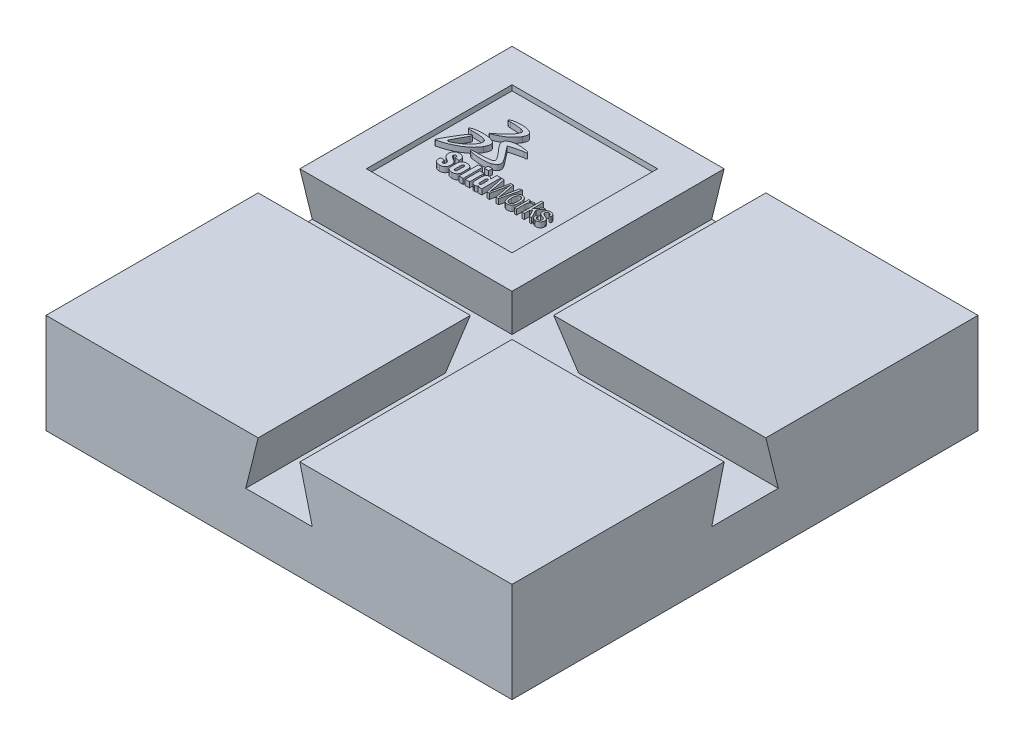
from build123d import *

# Parameters (mm, degrees)
SKETCH1_W          = 88.9
SKETCH1_H          = 88.9
BASE_EXTRUDE_DEPTH = 19.05
CUT_EXTRUDE1_DEPTH = 102.202346811
CUT_EXTRUDE2_DEPTH = 103.21917076
SKETCH8_W          = 27.774849227
SKETCH8_H          = 27.774849227
CUT_EXTRUDE4_DEPTH = 1.016
SKETCH7_W          = 0.807647572
SKETCH7_H          = 3.689453661
SKETCH7_W_2        = 0.825597864
SKETCH7_H_2        = 2.776797052
SKETCH7_H_3        = 0.698475923
EXTRUDE1_DEPTH     = 1.016


with BuildPart() as part:
    # Sketch1 → Base-Extrude (new body)
    with BuildSketch(Plane(origin=(0, 0, 0), x_dir=(1, 0, 0), z_dir=(0, 1, 0))):
        Rectangle(SKETCH1_W, SKETCH1_H)
    extrude(amount=BASE_EXTRUDE_DEPTH)

    # Sketch2 → Cut-Extrude1 (cut, through all)
    with BuildSketch(Plane.XY.offset(44.45)):
        Polygon((6.35, 9.525), (-6.35, 9.525), (-3.975150773, 19.05), (3.975150773, 19.05), align=None)
    extrude(amount=-CUT_EXTRUDE1_DEPTH, mode=Mode.SUBTRACT)

    # Sketch3 → Cut-Extrude2 (cut, through all)
    with BuildSketch(Plane(origin=(44.45, -3.538159269, -0.664564519), x_dir=(0, 0, -1), z_dir=(1, 0, 0))):
        Polygon((5.685435481, 13.063159269), (-7.014564519, 13.063159269), (-4.639715292, 22.588159269), (3.310586254, 22.588159269), align=None)
    extrude(amount=-CUT_EXTRUDE2_DEPTH, mode=Mode.SUBTRACT)

    # Sketch8 → Cut-Extrude4 (cut)
    with BuildSketch(Plane(origin=(0, 19.05, 0), x_dir=(-1, 0, 0), z_dir=(0, 1, 0))):
        with Locations((24.212575386, -24.212575386)):
            Rectangle(SKETCH8_W, SKETCH8_H)
    extrude(amount=-CUT_EXTRUDE4_DEPTH, mode=Mode.SUBTRACT)

    # Sketch7 → Extrude1 (add)
    # profile 1 of 14: a face of its own
    with BuildSketch(Plane(origin=(-67.01261786, 18.034, 30.420535438), x_dir=(1, 0, 0), z_dir=(0, 1, 0))):
        Polygon((51.349629564, 49.970708333), (52.291167219, 51.169291667), (52.701371045, 51.169291667), (51.87761312, 50.120642668), (52.763773299, 48.431204182), (52.320606228, 48.431204182), (51.611882291, 49.782365658), (51.349629564, 49.448516293), (51.349629564, 48.429902778), (50.929645629, 48.429902778), (50.929645629, 52.086861111), (51.349629564, 52.086861111), align=None)
    # profile 2 of 14: a face of its own
    with BuildSketch(Plane(origin=(-67.01261786, 18.034, 30.420535438), x_dir=(1, 0, 0), z_dir=(0, 1, 0))):
        with Locations((39.331135311, 50.242134281)):
            Rectangle(SKETCH7_W, SKETCH7_H)
    # profile 3 of 14: a face of its own
    with BuildSketch(Plane(origin=(-67.01261786, 18.034, 30.420535438), x_dir=(1, 0, 0), z_dir=(0, 1, 0))):
        with Locations((40.488775846, 49.818301304)):
            Rectangle(SKETCH7_W_2, SKETCH7_H_2)
    # profile 4 of 14: a face of its own
    with BuildSketch(Plane(origin=(-67.01261786, 18.034, 30.420535438), x_dir=(1, 0, 0), z_dir=(0, 1, 0))):
        with Locations((40.488775846, 52.436099072)):
            Rectangle(SKETCH7_W_2, SKETCH7_H_3)
    # profile 5 of 14: a face of its own
    with BuildSketch(Plane(origin=(-67.01261786, 18.034, 30.420535438), x_dir=(1, 0, 0), z_dir=(0, 1, 0))):
        with BuildLine():
            add(Edge.make_bspline(
                [(34.874736111, 62.6315), (34.701, 62.580638889), (34.350388889, 62.484194444), (34.380083333, 62.356361111)],
                knots=[0, 0, 0, 0, 1, 1, 1, 1], degree=3))
            add(Edge.make_bspline(
                [(34.380083333, 62.356361111), (34.398944444, 62.274305556), (34.468652778, 62.23525), (34.875625, 62.235652778)],
                knots=[0, 0, 0, 0, 1, 1, 1, 1], degree=3))
            add(Edge.make_bspline(
                [(34.875625, 62.235652778), (35.786263889, 62.236805556), (36.494208333, 62.177666667), (36.978833333, 62.090791667)],
                knots=[0, 0, 0, 0, 1, 1, 1, 1], degree=3))
            add(Edge.make_bspline(
                [(36.978833333, 62.090791667), (37.964888889, 61.912777778), (37.732680556, 61.415208333), (37.452458333, 60.938930556)],
                knots=[0, 0, 0, 0, 1, 1, 1, 1], degree=3))
            add(Edge.make_bspline(
                [(37.452458333, 60.938930556), (36.772458333, 59.779666667), (34.936111111, 58.475347222), (34.829569444, 58.401833333)],
                knots=[0, 0, 0, 0, 1, 1, 1, 1], degree=3))
            add(Edge.make_bspline(
                [(34.829569444, 58.401833333), (34.689597222, 58.305263889), (34.766097222, 58.249041667), (34.888513889, 58.294611111)],
                knots=[0, 0, 0, 0, 1, 1, 1, 1], degree=3))
            add(Edge.make_bspline(
                [(34.888513889, 58.294611111), (36.377569444, 58.848402778), (37.877944444, 59.803472222), (38.483888889, 60.963680556)],
                knots=[0, 0, 0, 0, 1, 1, 1, 1], degree=3))
            add(Edge.make_bspline(
                [(38.483888889, 60.963680556), (38.998, 61.947694444), (38.629486111, 62.414680556), (37.845930556, 62.634555556)],
                knots=[0, 0, 0, 0, 1, 1, 1, 1], degree=3))
            add(Edge.make_bspline(
                [(37.845930556, 62.634555556), (36.447277778, 63.028152778), (34.996875, 62.667638889), (34.874736111, 62.6315)],
                knots=[0, 0, 0, 0, 1, 1, 1, 1], degree=3))
        make_face()
    # profile 6 of 14: a face of its own
    with BuildSketch(Plane(origin=(-67.01261786, 18.034, 30.420535438), x_dir=(1, 0, 0), z_dir=(0, 1, 0))):
        with BuildLine():
            add(Edge.make_bspline(
                [(37.687583333, 58.660208333), (36.90775, 57.985902778), (38.064444444, 56.875), (38.608194444, 56.238069444)],
                knots=[0, 0, 0, 0, 1, 1, 1, 1], degree=3))
            add(Edge.make_bspline(
                [(38.608194444, 56.238069444), (39.1375, 55.619027778), (39.777972222, 54.833166667), (39.808083333, 54.563263889)],
                knots=[0, 0, 0, 0, 1, 1, 1, 1], degree=3))
            add(Edge.make_bspline(
                [(39.808083333, 54.563263889), (39.821638889, 54.439555556), (39.796958333, 54.298902778), (39.648777778, 54.207083333)],
                knots=[0, 0, 0, 0, 1, 1, 1, 1], degree=3))
            add(Edge.make_bspline(
                [(39.648777778, 54.207083333), (39.406541667, 54.055722222), (38.406444444, 53.909638889), (36.337819444, 53.911541667)],
                knots=[0, 0, 0, 0, 1, 1, 1, 1], degree=3))
            add(Edge.make_bspline(
                [(36.337819444, 53.911541667), (35.889013889, 53.911944444), (35.797458333, 53.868), (35.785930556, 53.787569444)],
                knots=[0, 0, 0, 0, 1, 1, 1, 1], degree=3))
            add(Edge.make_bspline(
                [(35.785930556, 53.787569444), (35.779555556, 53.745388889), (35.765791667, 53.648), (36.336805556, 53.5045)],
                knots=[0, 0, 0, 0, 1, 1, 1, 1], degree=3))
            add(Edge.make_bspline(
                [(36.336805556, 53.5045), (36.352263889, 53.500166667), (38.707611111, 53.067222222), (39.963791667, 53.5045)],
                knots=[0, 0, 0, 0, 1, 1, 1, 1], degree=3))
            add(Edge.make_bspline(
                [(39.963791667, 53.5045), (41.246944444, 53.942333333), (40.924138889, 54.681527778), (40.693833333, 55.108375)],
                knots=[0, 0, 0, 0, 1, 1, 1, 1], degree=3))
            add(Edge.make_bspline(
                [(40.693833333, 55.108375), (40.339361111, 55.766055556), (38.704013889, 57.678222222), (38.569069444, 57.938166667)],
                knots=[0, 0, 0, 0, 1, 1, 1, 1], degree=3))
            add(Edge.make_bspline(
                [(41.080791667, 58.598430556), (40.938049657, 58.599550827), (38.535399297, 58.003025711), (38.569069444, 57.938166667)],
                knots=[0, 0, 0, 0, 1, 1, 1, 1], degree=3))
            add(Edge.make_bspline(
                [(41.080791667, 58.598430556), (41.530291667, 58.594902778), (41.623597222, 58.641833333), (41.634041667, 58.722736111)],
                knots=[0, 0, 0, 0, 1, 1, 1, 1], degree=3))
            add(Edge.make_bspline(
                [(41.634041667, 58.722736111), (41.642861111, 58.789666667), (41.514555556, 58.935138889), (41.087166667, 59.026555556)],
                knots=[0, 0, 0, 0, 1, 1, 1, 1], degree=3))
            add(Edge.make_bspline(
                [(41.087166667, 59.026555556), (40.684208333, 59.113222222), (38.623111111, 59.468930556), (37.687583333, 58.660208333)],
                knots=[0, 0, 0, 0, 1, 1, 1, 1], degree=3))
        make_face()
    # profile 7 of 14: a face of its own
    with BuildSketch(Plane(origin=(-67.01261786, 18.034, 30.420535438), x_dir=(1, 0, 0), z_dir=(0, 1, 0))):
        with BuildLine():
            add(Edge.make_bspline(
                [(35.763888889, 57.537430556), (34.312541667, 57.966722222), (32.730375, 57.593722222), (32.489013889, 57.529708333)],
                knots=[0, 0, 0, 0, 1, 1, 1, 1], degree=3))
            add(Edge.make_bspline(
                [(32.489013889, 57.529708333), (32.12375, 57.432930556), (31.909583333, 57.335277778), (31.9245, 57.220791667)],
                knots=[0, 0, 0, 0, 1, 1, 1, 1], degree=3))
            add(Edge.make_bspline(
                [(31.9245, 57.220791667), (31.935972222, 57.136236111), (32.029277778, 57.077972222), (32.478361111, 57.089027778)],
                knots=[0, 0, 0, 0, 1, 1, 1, 1], degree=3))
            add(Edge.make_bspline(
                [(32.478361111, 57.089027778), (33.548513889, 57.115), (34.435361111, 57.078861111), (34.995722222, 56.921861111)],
                knots=[0, 0, 0, 0, 1, 1, 1, 1], degree=3))
            add(Edge.make_bspline(
                [(34.995722222, 56.921861111), (35.689902778, 56.728180556), (35.775208333, 56.370708333), (35.431722222, 55.668263889)],
                knots=[0, 0, 0, 0, 1, 1, 1, 1], degree=3))
            add(Edge.make_bspline(
                [(35.431722222, 55.668263889), (35.272694444, 55.343694444), (35.037569444, 55.008138889), (34.681527778, 54.651694444)],
                knots=[0, 0, 0, 0, 1, 1, 1, 1], degree=3))
            add(Edge.make_bspline(
                [(34.681527778, 54.651694444), (33.970875, 53.938805556), (33.08275, 53.474527778), (32.582402778, 53.221305556)],
                knots=[0, 0, 0, 0, 1, 1, 1, 1], degree=3))
            add(Edge.make_bspline(
                [(32.582402778, 53.221305556), (32.09575, 52.974444444), (31.917930556, 53.105472222), (31.971972222, 53.349069444)],
                knots=[0, 0, 0, 0, 1, 1, 1, 1], degree=3))
            add(Edge.make_bspline(
                [(31.971972222, 53.349069444), (31.976340303, 53.368758926), (33.368260133, 55.947613541), (33.418777778, 56.035902778)],
                knots=[0, 0, 0, 0, 1, 1, 1, 1], degree=3))
            add(Edge.make_bspline(
                [(33.418777778, 56.035902778), (33.522541667, 56.21725), (33.540791667, 56.387666667), (33.418777778, 56.438666667)],
                knots=[0, 0, 0, 0, 1, 1, 1, 1], degree=3))
            add(Edge.make_bspline(
                [(33.418777778, 56.438666667), (33.314069444, 56.483083333), (33.124388889, 56.336055556), (32.92725, 56.108125)],
                knots=[0, 0, 0, 0, 1, 1, 1, 1], degree=3))
            add(Edge.make_bspline(
                [(32.92725, 56.108125), (32.121722222, 55.172527778), (30.635916667, 52.325847222), (30.608513889, 52.232263889)],
                knots=[0, 0, 0, 0, 1, 1, 1, 1], degree=3))
            add(Edge.make_bspline(
                [(30.608513889, 52.232263889), (30.581125, 52.142736111), (30.650972222, 52.131625), (30.677763889, 52.131083333)],
                knots=[0, 0, 0, 0, 1, 1, 1, 1], degree=3))
            add(Edge.make_bspline(
                [(30.677763889, 52.131083333), (31.306763889, 52.135694444), (35.168722222, 53.278), (36.414861111, 55.612527778)],
                knots=[0, 0, 0, 0, 1, 1, 1, 1], degree=3))
            add(Edge.make_bspline(
                [(36.414861111, 55.612527778), (37.070986111, 56.841902778), (36.739027778, 57.248666667), (35.763888889, 57.537430556)],
                knots=[0, 0, 0, 0, 1, 1, 1, 1], degree=3))
        make_face()
    # profile 8 of 14: a face of its own
    with BuildSketch(Plane(origin=(-67.01261786, 18.034, 30.420535438), x_dir=(1, 0, 0), z_dir=(0, 1, 0))):
        with BuildLine():
            add(Edge.make_bspline(
                [(54.047583333, 50.413958333), (54.062777778, 50.736222222), (53.946944444, 50.887319444), (53.618430556, 50.887319444)],
                knots=[0, 0, 0, 0, 1, 1, 1, 1], degree=3))
            add(Edge.make_bspline(
                [(53.618430556, 50.887319444), (53.345541667, 50.887319444), (53.189555556, 50.759819444), (53.189555556, 50.477152778)],
                knots=[0, 0, 0, 0, 1, 1, 1, 1], degree=3))
            add(Edge.make_bspline(
                [(53.189555556, 50.477152778), (53.189555556, 50.126958333), (53.477375, 50.082194444), (53.741597222, 49.970708333)],
                knots=[0, 0, 0, 0, 1, 1, 1, 1], degree=3))
            add(Edge.make_bspline(
                [(53.741597222, 49.970708333), (54.130583333, 49.793972222), (54.521486111, 49.697263889), (54.521486111, 49.19)],
                knots=[0, 0, 0, 0, 1, 1, 1, 1], degree=3))
            add(Edge.make_bspline(
                [(54.521486111, 49.19), (54.521486111, 48.672694444), (54.160430556, 48.350416667), (53.603513889, 48.355847222)],
                knots=[0, 0, 0, 0, 1, 1, 1, 1], degree=3))
            add(Edge.make_bspline(
                [(53.603513889, 48.355847222), (53.364805556, 48.350416667), (53.072916667, 48.433569444), (52.930777778, 48.638513889)],
                knots=[0, 0, 0, 0, 1, 1, 1, 1], degree=3))
            add(Edge.make_bspline(
                [(52.930777778, 48.638513889), (52.770180556, 48.852944444), (52.779402778, 49.033611111), (52.779402778, 49.219027778)],
                knots=[0, 0, 0, 0, 1, 1, 1, 1], degree=3))
            Line((52.779402778, 49.219027778), (53.146152778, 49.219027778))
            add(Edge.make_bspline(
                [(53.146152778, 49.219027778), (53.131777778, 48.887263889), (53.243541667, 48.682180556), (53.603513889, 48.682180556)],
                knots=[0, 0, 0, 0, 1, 1, 1, 1], degree=3))
            add(Edge.make_bspline(
                [(53.603513889, 48.682180556), (53.917375, 48.682180556), (54.121638889, 48.809402778), (54.121638889, 49.140902778)],
                knots=[0, 0, 0, 0, 1, 1, 1, 1], degree=3))
            add(Edge.make_bspline(
                [(54.121638889, 49.140902778), (54.121638889, 49.526097222), (53.731277778, 49.560541667), (53.453236111, 49.678)],
                knots=[0, 0, 0, 0, 1, 1, 1, 1], degree=3))
            add(Edge.make_bspline(
                [(53.453236111, 49.678), (53.033861111, 49.833444444), (52.789708333, 49.975041667), (52.789708333, 50.447597222)],
                knots=[0, 0, 0, 0, 1, 1, 1, 1], degree=3))
            add(Edge.make_bspline(
                [(52.789708333, 50.447597222), (52.789708333, 50.917152778), (53.116861111, 51.214597222), (53.585069444, 51.214597222)],
                knots=[0, 0, 0, 0, 1, 1, 1, 1], degree=3))
            add(Edge.make_bspline(
                [(53.585069444, 51.214597222), (54.121638889, 51.214597222), (54.433597222, 50.969513889), (54.423555556, 50.413958333)],
                knots=[0, 0, 0, 0, 1, 1, 1, 1], degree=3))
            Line((54.423555556, 50.413958333), (54.047583333, 50.413958333))
        make_face()
    # profile 9 of 14: a face of its own
    with BuildSketch(Plane(origin=(-67.01261786, 18.034, 30.420535438), x_dir=(1, 0, 0), z_dir=(0, 1, 0))):
        with BuildLine():
            Line((49.869513889, 50.697694444), (49.879555556, 50.697694444))
            add(Edge.make_bspline(
                [(49.879555556, 50.697694444), (50.039875, 51.053333333), (50.269916667, 51.204430556), (50.673555556, 51.169291667)],
                knots=[0, 0, 0, 0, 1, 1, 1, 1], degree=3))
            Line((50.673555556, 51.169291667), (50.673555556, 50.789527778))
            add(Edge.make_bspline(
                [(50.673555556, 50.789527778), (50.176319444, 50.877555556), (49.883361111, 50.565597222), (49.883361111, 50.073236111)],
                knots=[0, 0, 0, 0, 1, 1, 1, 1], degree=3))
            Line((49.883361111, 50.073236111), (49.883361111, 48.429902778))
            Line((49.883361111, 48.429902778), (49.498152778, 48.429902778))
            Line((49.498152778, 48.429902778), (49.498152778, 51.140680556))
            Line((49.498152778, 51.140680556), (49.869513889, 51.140680556))
            Line((49.869513889, 51.140680556), (49.869513889, 50.697694444))
        make_face()
    # profile 10 of 14: a face of its own
    with BuildSketch(Plane(origin=(-67.01261786, 18.034, 30.420535438), x_dir=(1, 0, 0), z_dir=(0, 1, 0))):
        with BuildLine():
            add(Edge.make_bspline(
                [(48.168944444, 48.355847222), (47.584097222, 48.355847222), (47.199166667, 48.707138889), (47.199166667, 49.877388889)],
                knots=[0, 0, 0, 0, 1, 1, 1, 1], degree=3))
            add(Edge.make_bspline(
                [(47.199166667, 49.877388889), (47.199166667, 50.697694444), (47.500819444, 51.214597222), (48.168944444, 51.214597222)],
                knots=[0, 0, 0, 0, 1, 1, 1, 1], degree=3))
            add(Edge.make_bspline(
                [(48.168944444, 51.214597222), (48.837625, 51.214597222), (49.140625, 50.697694444), (49.140625, 49.877388889)],
                knots=[0, 0, 0, 0, 1, 1, 1, 1], degree=3))
            add(Edge.make_bspline(
                [(49.140625, 49.877388889), (49.140625, 48.702805556), (48.764375, 48.355847222), (48.168944444, 48.355847222)],
                knots=[0, 0, 0, 0, 1, 1, 1, 1], degree=3))
        make_face()
        with BuildLine():
            add(Edge.make_bspline(
                [(48.168944444, 50.887319444), (47.775069444, 50.887319444), (47.598472222, 50.575902778), (47.598472222, 49.755319444)],
                knots=[0, 0, 0, 0, 1, 1, 1, 1], degree=3))
            add(Edge.make_bspline(
                [(47.598472222, 49.755319444), (47.598472222, 49.116486111), (47.720805556, 48.682180556), (48.168944444, 48.682180556)],
                knots=[0, 0, 0, 0, 1, 1, 1, 1], degree=3))
            add(Edge.make_bspline(
                [(48.168944444, 48.682180556), (48.627111111, 48.682180556), (48.739416667, 49.116486111), (48.739416667, 49.755319444)],
                knots=[0, 0, 0, 0, 1, 1, 1, 1], degree=3))
            add(Edge.make_bspline(
                [(48.739416667, 49.755319444), (48.739416667, 50.575902778), (48.574486111, 50.887319444), (48.168944444, 50.887319444)],
                knots=[0, 0, 0, 0, 1, 1, 1, 1], degree=3))
        make_face(mode=Mode.SUBTRACT)
    # profile 11 of 14: a face of its own
    with BuildSketch(Plane(origin=(-67.01261786, 18.034, 30.420535438), x_dir=(1, 0, 0), z_dir=(0, 1, 0))):
        with BuildLine():
            Line((44.695361111, 48.429902778), (44.192305556, 48.429902778))
            Line((44.192305556, 48.429902778), (43.412541667, 52.086861111))
            Line((43.412541667, 52.086861111), (43.861486111, 52.086861111))
            Line((43.861486111, 52.086861111), (44.33825, 49.565152778))
            add(Edge.make_bspline(
                [(44.33825, 49.565152778), (44.382597222, 49.316944444), (44.417041667, 49.063041667), (44.44675, 48.721791667)],
                knots=[0, 0, 0, 0, 1, 1, 1, 1], degree=3))
            Line((44.44675, 48.721791667), (44.456111111, 48.721791667))
            add(Edge.make_bspline(
                [(44.456111111, 48.721791667), (44.490152778, 49.004180556), (44.519319444, 49.272458333), (44.573430556, 49.536138889)],
                knots=[0, 0, 0, 0, 1, 1, 1, 1], degree=3))
            Line((44.573430556, 49.536138889), (45.109861111, 52.086861111))
            Line((45.109861111, 52.086861111), (45.611430556, 52.086861111))
            Line((45.611430556, 52.086861111), (46.095916667, 49.565152778))
            add(Edge.make_bspline(
                [(46.095916667, 49.565152778), (46.137972222, 49.321291667), (46.167263889, 49.077833333), (46.201708333, 48.721791667)],
                knots=[0, 0, 0, 0, 1, 1, 1, 1], degree=3))
            Line((46.201708333, 48.721791667), (46.212027778, 48.721791667))
            add(Edge.make_bspline(
                [(46.212027778, 48.721791667), (46.245666667, 49.004180556), (46.274958333, 49.272458333), (46.329208333, 49.536138889)],
                knots=[0, 0, 0, 0, 1, 1, 1, 1], degree=3))
            Line((46.329208333, 49.536138889), (46.860083333, 52.086861111))
            Line((46.860083333, 52.086861111), (47.309847222, 52.086861111))
            Line((47.309847222, 52.086861111), (46.451277778, 48.429902778))
            Line((46.451277778, 48.429902778), (45.949166667, 48.429902778))
            Line((45.949166667, 48.429902778), (45.461430556, 50.911736111))
            add(Edge.make_bspline(
                [(45.461430556, 50.911736111), (45.413, 51.150847222), (45.384111111, 51.394319444), (45.353736111, 51.794430556)],
                knots=[0, 0, 0, 0, 1, 1, 1, 1], degree=3))
            Line((45.353736111, 51.794430556), (45.343555556, 51.794430556))
            add(Edge.make_bspline(
                [(45.343555556, 51.794430556), (45.310333333, 51.442875), (45.280625, 51.175944444), (45.227055556, 50.911736111)],
                knots=[0, 0, 0, 0, 1, 1, 1, 1], degree=3))
            Line((45.227055556, 50.911736111), (44.695361111, 48.429902778))
        make_face()
    # profile 12 of 14: a face of its own
    with BuildSketch(Plane(origin=(-67.01261786, 18.034, 30.420535438), x_dir=(1, 0, 0), z_dir=(0, 1, 0))):
        with BuildLine():
            Line((42.514652778, 48.429902778), (42.514652778, 48.746069444))
            Line((42.514652778, 48.746069444), (42.505430556, 48.746069444))
            add(Edge.make_bspline(
                [(42.505430556, 48.746069444), (42.363138889, 48.482125), (42.129319444, 48.341194444), (41.900569444, 48.341194444)],
                knots=[0, 0, 0, 0, 1, 1, 1, 1], degree=3))
            add(Edge.make_bspline(
                [(41.900569444, 48.341194444), (41.334569444, 48.360736111), (41.221861111, 48.892138889), (41.221861111, 49.356013889)],
                knots=[0, 0, 0, 0, 1, 1, 1, 1], degree=3))
            Line((41.221861111, 49.356013889), (41.221861111, 50.301652778))
            add(Edge.make_bspline(
                [(41.221861111, 50.301652778), (41.221861111, 50.731194444), (41.373222222, 51.238611111), (41.885916667, 51.238611111)],
                knots=[0, 0, 0, 0, 1, 1, 1, 1], degree=3))
            add(Edge.make_bspline(
                [(41.885916667, 51.238611111), (42.091402778, 51.238611111), (42.290111111, 51.150847222), (42.450430556, 50.911736111)],
                knots=[0, 0, 0, 0, 1, 1, 1, 1], degree=3))
            Line((42.450430556, 50.911736111), (42.460805556, 50.911736111))
            Line((42.460805556, 50.911736111), (42.460805556, 52.086861111))
            Line((42.460805556, 52.086861111), (43.236763889, 52.086861111))
            Line((43.236763889, 52.086861111), (43.236763889, 48.429902778))
            Line((43.236763889, 48.429902778), (42.514652778, 48.429902778))
        make_face()
        with BuildLine():
            add(Edge.make_bspline(
                [(41.997958333, 49.414472222), (41.997958333, 49.253069444), (41.997958333, 48.975416667), (42.22175, 48.975416667)],
                knots=[0, 0, 0, 0, 1, 1, 1, 1], degree=3))
            add(Edge.make_bspline(
                [(42.22175, 48.975416667), (42.431166667, 48.975416667), (42.460805556, 49.184569444), (42.460805556, 49.448791667)],
                knots=[0, 0, 0, 0, 1, 1, 1, 1], degree=3))
            Line((42.460805556, 49.448791667), (42.460805556, 50.0925))
            add(Edge.make_bspline(
                [(42.460805556, 50.0925), (42.460805556, 50.326611111), (42.426152778, 50.609541667), (42.235986111, 50.603847222)],
                knots=[0, 0, 0, 0, 1, 1, 1, 1], degree=3))
            add(Edge.make_bspline(
                [(42.235986111, 50.603847222), (41.988319444, 50.603847222), (41.997958333, 50.2965), (41.997958333, 50.121125)],
                knots=[0, 0, 0, 0, 1, 1, 1, 1], degree=3))
            Line((41.997958333, 50.121125), (41.997958333, 49.414472222))
        make_face(mode=Mode.SUBTRACT)
    # profile 13 of 14: a face of its own
    with BuildSketch(Plane(origin=(-67.01261786, 18.034, 30.420535438), x_dir=(1, 0, 0), z_dir=(0, 1, 0))):
        with BuildLine():
            add(Edge.make_bspline(
                [(36.61025, 50.301652778), (36.61025, 51.004638889), (37.025208333, 51.238611111), (37.624444444, 51.238611111)],
                knots=[0, 0, 0, 0, 1, 1, 1, 1], degree=3))
            add(Edge.make_bspline(
                [(37.624444444, 51.238611111), (38.307902778, 51.238611111), (38.639125, 50.917152778), (38.639125, 50.301652778)],
                knots=[0, 0, 0, 0, 1, 1, 1, 1], degree=3))
            Line((38.639125, 50.301652778), (38.639125, 49.19))
            add(Edge.make_bspline(
                [(38.639125, 49.19), (38.599652778, 48.570416667), (38.214861111, 48.341194444), (37.624444444, 48.341194444)],
                knots=[0, 0, 0, 0, 1, 1, 1, 1], degree=3))
            add(Edge.make_bspline(
                [(37.624444444, 48.341194444), (37.068486111, 48.341194444), (36.61025, 48.565263889), (36.61025, 49.19)],
                knots=[0, 0, 0, 0, 1, 1, 1, 1], degree=3))
            Line((36.61025, 49.19), (36.61025, 50.301652778))
        make_face()
        with BuildLine():
            add(Edge.make_bspline(
                [(37.386472222, 49.140902778), (37.400444444, 48.984652778), (37.464527778, 48.901916667), (37.624444444, 48.901916667)],
                knots=[0, 0, 0, 0, 1, 1, 1, 1], degree=3))
            add(Edge.make_bspline(
                [(37.624444444, 48.901916667), (37.785847222, 48.901916667), (37.848652778, 48.984652778), (37.863708333, 49.140902778)],
                knots=[0, 0, 0, 0, 1, 1, 1, 1], degree=3))
            Line((37.863708333, 49.140902778), (37.863708333, 50.361055556))
            add(Edge.make_bspline(
                [(37.863708333, 50.361055556), (37.863708333, 50.53575), (37.80525, 50.677902778), (37.624444444, 50.677902778)],
                knots=[0, 0, 0, 0, 1, 1, 1, 1], degree=3))
            add(Edge.make_bspline(
                [(37.624444444, 50.677902778), (37.444055556, 50.677902778), (37.386472222, 50.53575), (37.386472222, 50.361055556)],
                knots=[0, 0, 0, 0, 1, 1, 1, 1], degree=3))
            Line((37.386472222, 50.361055556), (37.386472222, 49.140902778))
        make_face(mode=Mode.SUBTRACT)
    # profile 14 of 14: a face of its own
    with BuildSketch(Plane(origin=(-67.01261786, 18.034, 30.420535438), x_dir=(1, 0, 0), z_dir=(0, 1, 0))):
        with BuildLine():
            Line((34.939375, 49.653458333), (34.939375, 49.394388889))
            add(Edge.make_bspline(
                [(34.939375, 49.394388889), (34.939375, 49.184569444), (35.008472222, 48.999152778), (35.280958333, 48.999152778)],
                knots=[0, 0, 0, 0, 1, 1, 1, 1], degree=3))
            add(Edge.make_bspline(
                [(35.280958333, 48.999152778), (35.481097222, 48.999152778), (35.568777778, 49.179694444), (35.568777778, 49.365375)],
                knots=[0, 0, 0, 0, 1, 1, 1, 1], degree=3))
            add(Edge.make_bspline(
                [(35.568777778, 49.365375), (35.568777778, 49.672583333), (35.315277778, 49.789222222), (35.091277778, 49.926347222)],
                knots=[0, 0, 0, 0, 1, 1, 1, 1], degree=3))
            add(Edge.make_bspline(
                [(35.091277778, 49.926347222), (34.827, 50.077444444), (34.603277778, 50.218916667), (34.442888889, 50.403916667)],
                knots=[0, 0, 0, 0, 1, 1, 1, 1], degree=3))
            add(Edge.make_bspline(
                [(34.442888889, 50.403916667), (34.285611111, 50.590277778), (34.192916667, 50.814208333), (34.192916667, 51.136611111)],
                knots=[0, 0, 0, 0, 1, 1, 1, 1], degree=3))
            add(Edge.make_bspline(
                [(34.192916667, 51.136611111), (34.192916667, 51.823736111), (34.607611111, 52.175430556), (35.271, 52.175430556)],
                knots=[0, 0, 0, 0, 1, 1, 1, 1], degree=3))
            add(Edge.make_bspline(
                [(35.271, 52.175430556), (36.018402778, 52.175430556), (36.398722222, 51.677791667), (36.358916667, 50.990402778)],
                knots=[0, 0, 0, 0, 1, 1, 1, 1], degree=3))
            Line((36.358916667, 50.990402778), (35.568777778, 50.990402778))
            add(Edge.make_bspline(
                [(35.568777778, 50.990402778), (35.558736111, 51.204430556), (35.568777778, 51.497263889), (35.285583333, 51.516652778)],
                knots=[0, 0, 0, 0, 1, 1, 1, 1], degree=3))
            add(Edge.make_bspline(
                [(35.285583333, 51.516652778), (35.110541667, 51.531305556), (35.008472222, 51.433111111), (34.988541667, 51.273194444)],
                knots=[0, 0, 0, 0, 1, 1, 1, 1], degree=3))
            add(Edge.make_bspline(
                [(34.988541667, 51.273194444), (34.963722222, 51.053333333), (35.076569444, 50.941027778), (35.246916667, 50.82425)],
                knots=[0, 0, 0, 0, 1, 1, 1, 1], degree=3))
            add(Edge.make_bspline(
                [(35.246916667, 50.82425), (35.568777778, 50.618763889), (35.846555556, 50.492083333), (36.047430556, 50.307347222)],
                knots=[0, 0, 0, 0, 1, 1, 1, 1], degree=3))
            add(Edge.make_bspline(
                [(36.047430556, 50.307347222), (36.246819444, 50.121125), (36.364, 49.877388889), (36.364, 49.433458333)],
                knots=[0, 0, 0, 0, 1, 1, 1, 1], degree=3))
            add(Edge.make_bspline(
                [(36.364, 49.433458333), (36.364, 48.731416667), (35.973652778, 48.341194444), (35.261708333, 48.341194444)],
                knots=[0, 0, 0, 0, 1, 1, 1, 1], degree=3))
            add(Edge.make_bspline(
                [(35.261708333, 48.341194444), (34.475708333, 48.341194444), (34.144972222, 48.779708333), (34.144972222, 49.262694444)],
                knots=[0, 0, 0, 0, 1, 1, 1, 1], degree=3))
            Line((34.144972222, 49.262694444), (34.144972222, 49.653458333))
            Line((34.144972222, 49.653458333), (34.939375, 49.653458333))
        make_face()
    extrude(amount=EXTRUDE1_DEPTH)


solid = part.part
